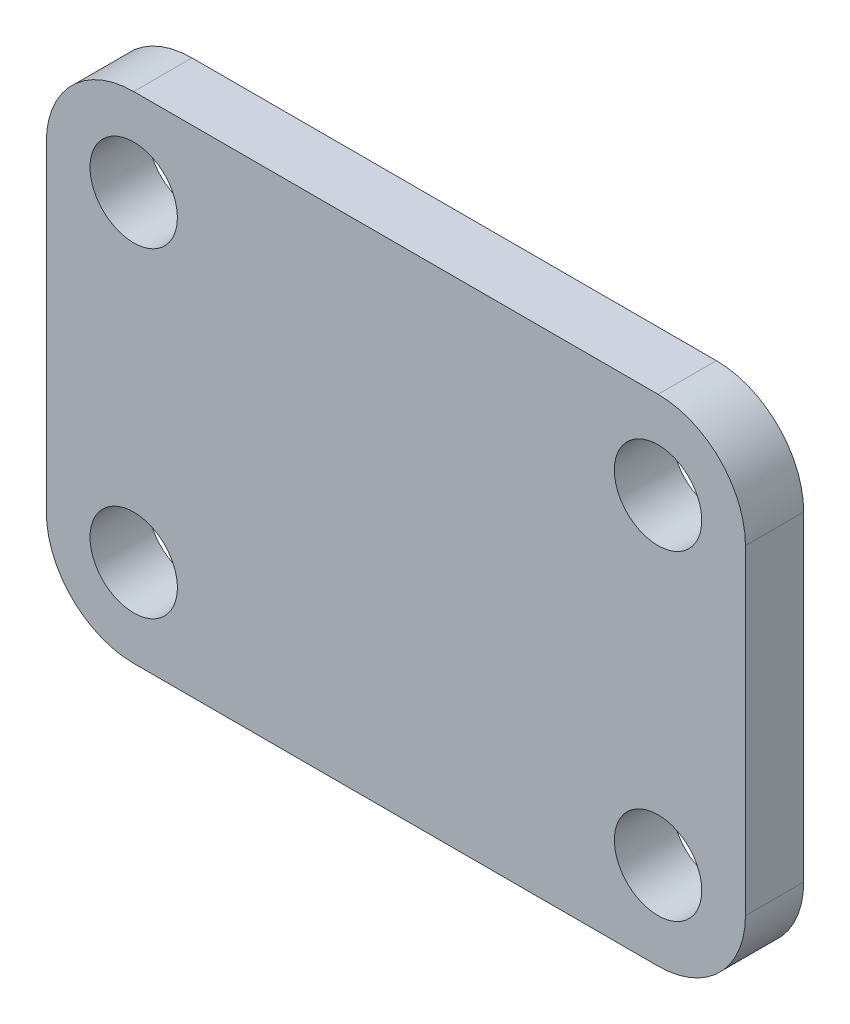
from build123d import *

# Parameters (mm, degrees)
ESBO_O1_W                = 24
ESBO_O1_H                = 17
ESBO_O1_R                = 1.5
RESSALTO_EXTRUS_O1_DEPTH = 1
FILETE1_R                = 3


with BuildPart() as part:
    # Esboço1 → Ressalto-extrusão1 (new, symmetric)
    with BuildSketch(Plane.XY):
        Rectangle(ESBO_O1_W, ESBO_O1_H)
        with Locations((-9, 5.5)):
            Circle(ESBO_O1_R, mode=Mode.SUBTRACT)
        with Locations(Location((9, 5.5, 0), (0, 0, 180))):
            Circle(ESBO_O1_R, mode=Mode.SUBTRACT)
        with Locations((9, -5.5)):
            Circle(ESBO_O1_R, mode=Mode.SUBTRACT)
        with Locations(Location((-9, -5.5, 0), (0, 0, 180))):
            Circle(ESBO_O1_R, mode=Mode.SUBTRACT)
    extrude(amount=RESSALTO_EXTRUS_O1_DEPTH, both=True)

    # Filete1
    filete1_edges = [part.edges().sort_by_distance(p)[0] for p in [
        (12, -8.5, 0),
        (-12, -8.5, 0),
        (-12, 8.5, 0),
        (12, 8.5, 0),
    ]]
    fillet(filete1_edges, radius=FILETE1_R)


solid = part.part
